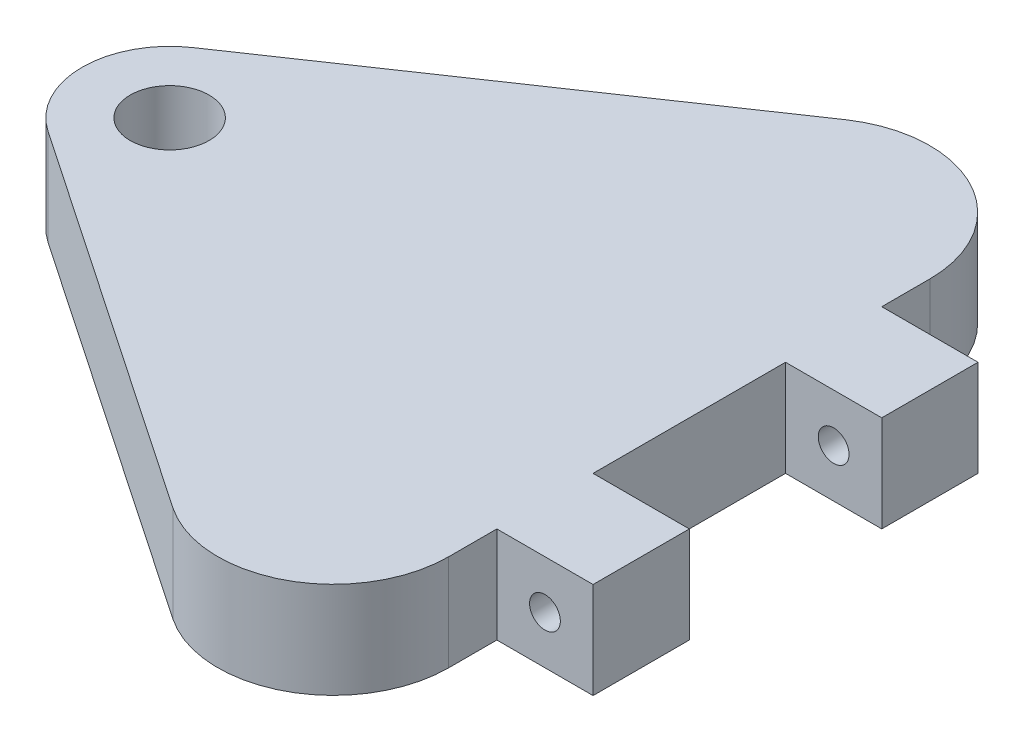
from build123d import *

# Parameters (mm, degrees)
SKETCH_1_R               = 4.1
EXTRUDE_1_DEPTH          = 10
SKETCH_2_W               = 10.2
SKETCH_2_H               = 10.2
CUT_EXTRUDE_1_DEPTH      = 5
SKETCH_3_W               = 10
SKETCH_3_H               = 10
EXTRUDE_2_DEPTH          = 10
CUT_EXTRUDE_2_DEPTH      = 64.876521508
CUT_EXTRUDE_2_DEPTH_BACK = 64.876521508
SKETCH_4_R               = 1.6


with BuildPart() as part:
    # ｽｹｯﾁ1 → ﾎﾞｽ - 押し出し1 (new body)
    with BuildSketch(Plane(origin=(0, 0, 0), x_dir=(1, 0, 0), z_dir=(0, 1, 0))):
        with BuildLine():
            Line((-47.110254718, 7.529627927), (-6.738797431, 34.929179684))
            ThreePointArc((-6.738797431, 34.929179684), (5.618470914, 35.603432679), (12, 25))
            Line((12, 25), (12, -25))
            ThreePointArc((12, -25), (5.618470914, -35.603432679), (-6.738797431, -34.929179684))
            Line((-6.738797431, -34.929179684), (-47.110254718, -7.529627927))
            ThreePointArc((-47.110254718, -7.529627927), (-51.1, 0), (-47.110254718, 7.529627927))
        make_face()
        with Locations(Location((-42, 0, 0), (0, 0, 270))):
            Circle(SKETCH_1_R, mode=Mode.SUBTRACT)
    extrude(amount=EXTRUDE_1_DEPTH)

    # ｽｹｯﾁ2 → ｶｯﾄ - 押し出し1 (cut)
    with BuildSketch(Plane.XZ):
        with Locations((0, 25)):
            Rectangle(SKETCH_2_W, SKETCH_2_H)
        with Locations((0, -25)):
            Rectangle(SKETCH_2_W, SKETCH_2_H)
        with Locations((-20, 0)):
            Rectangle(SKETCH_2_W, SKETCH_2_H)
    extrude(amount=-CUT_EXTRUDE_1_DEPTH, mode=Mode.SUBTRACT)

    # ｽｹｯﾁ3 → ﾎﾞｽ - 押し出し2 (add)
    with BuildSketch(Plane(origin=(12, 0, 0), x_dir=(0, 0, -1), z_dir=(1, 0, 0))):
        with Locations((-15, 5)):
            Rectangle(SKETCH_3_W, SKETCH_3_H)
        with Locations((15, 5)):
            Rectangle(SKETCH_3_W, SKETCH_3_H)
    extrude(amount=EXTRUDE_2_DEPTH)

    # ｽｹｯﾁ4 → ｶｯﾄ - 押し出し2 (cut, two sides: drawn at the far end of the back side and taken through both)
    with BuildSketch(Plane.XY.offset(-CUT_EXTRUDE_2_DEPTH_BACK)):
        with Locations((17, 5)):
            Circle(SKETCH_4_R)
    extrude(amount=CUT_EXTRUDE_2_DEPTH + CUT_EXTRUDE_2_DEPTH_BACK, mode=Mode.SUBTRACT)


solid = part.part
